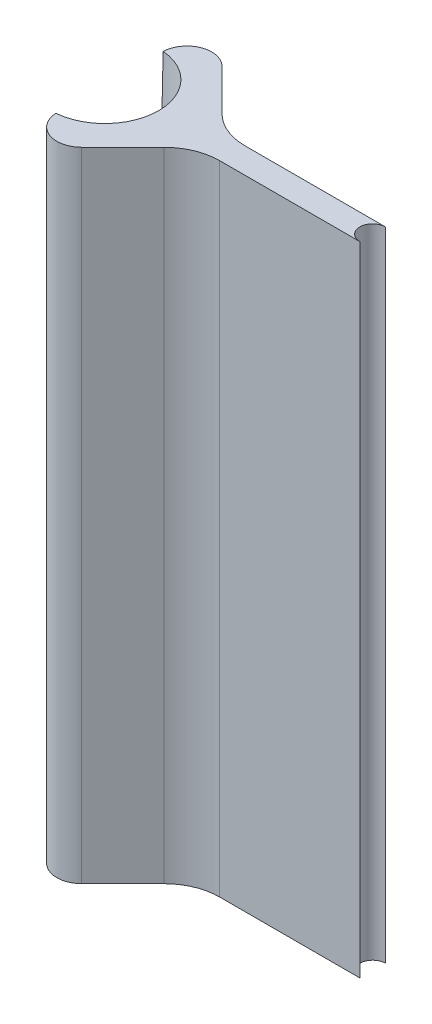
from build123d import *

# Parameters (mm, degrees)
BOSS_EXTRUDE2_DEPTH = 10
SKETCH5_R           = 0.635
CUT_EXTRUDE1_DEPTH  = 10
CUT_EXTRUDE1_DRAFT  = 1.2


with BuildPart() as part:
    # Sketch2 → Boss-Extrude2 (new body)
    with BuildSketch(Plane(origin=(0, 0, 0), x_dir=(1, 0, 0), z_dir=(0, 1, 0))):
        with BuildLine():
            Line((0.055343897, 0.632583633), (0.075113859, 0.858555332))
            ThreePointArc((0.075113859, 0.858555332), (0.329887136, 1.190582332), (0.738477631, 1.1))
            Line((0.738477631, 1.1), (1.382842712, 0.455634919))
            ThreePointArc((1.382842712, 0.455634919), (1.665996883, 0.266437351), (2, 0.2))
            Line((2, 0.2), (4.2, 0.2))
            ThreePointArc((4.2, 0.2), (4, 0), (4.2, -0.2))
            Line((4.2, -0.2), (2, -0.2))
            ThreePointArc((2, -0.2), (1.665996883, -0.266437351), (1.382842712, -0.455634919))
            Line((1.382842712, -0.455634919), (0.738477631, -1.1))
            ThreePointArc((0.738477631, -1.1), (0.329887136, -1.190582332), (0.075113859, -0.858555332))
            Line((0.075113859, -0.858555332), (0.055343897, -0.632583633))
            Line((0.055343897, -0.632583633), (0.055343897, 0.632583633))
        make_face()
    extrude(amount=BOSS_EXTRUDE2_DEPTH)


with BuildPart() as cut_extrude1_tool:
    # Sketch5 → Cut-Extrude1 (with draft: the straight prism first)
    with BuildSketch(Plane.XZ):
        Circle(SKETCH5_R)
    extrude(amount=-CUT_EXTRUDE1_DEPTH)
    # Cut-Extrude1: the draft: its side faces are tilted about the plane it starts from
    cut_extrude1_sides = [cut_extrude1_tool.faces().sort_by_distance(p)[0] for p in [
        (-0.635, 5, 0),
    ]]
    draft(cut_extrude1_sides, Plane.XZ, CUT_EXTRUDE1_DRAFT)


with BuildPart() as part_1:
    add(part.part)

    # Cut-Extrude1: cut by cut_extrude1_tool
    add(cut_extrude1_tool.part, mode=Mode.SUBTRACT)


solid = part_1.part
